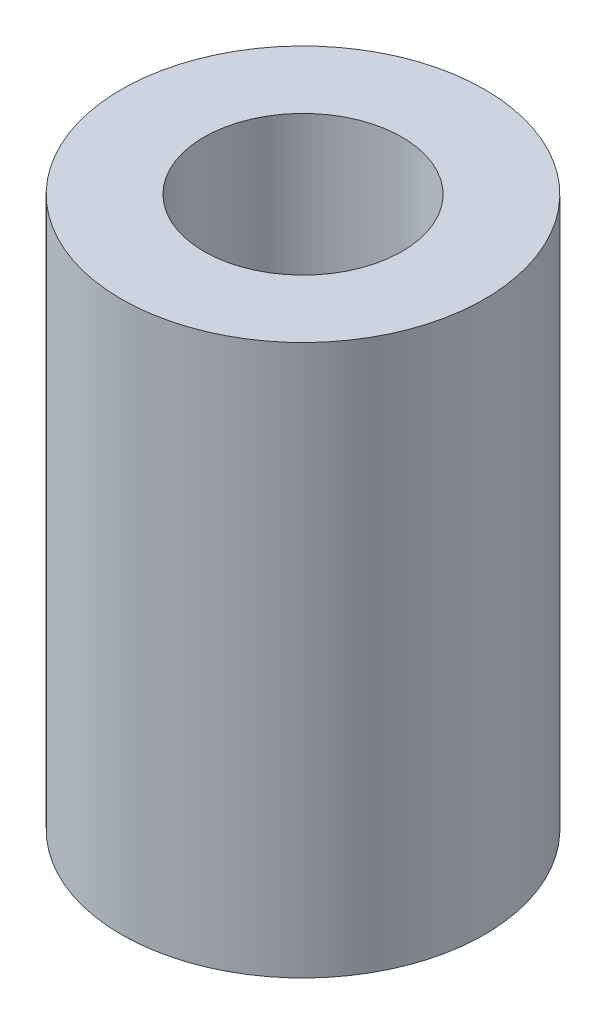
from build123d import *

# Parameters (mm, degrees)
SKETCH1_R           = 3.3
SKETCH1_R_2         = 1.8
BOSS_EXTRUDE1_DEPTH = 10


with BuildPart() as part:
    # Sketch1 → Boss-Extrude1 (new body)
    with BuildSketch(Plane(origin=(0, 0, 0), x_dir=(1, 0, 0), z_dir=(0, 1, 0))):
        with Locations(Location((0, 0, 0), (0, 0, 270))):
            Circle(SKETCH1_R)
        with Locations(Location((0, 0, 0), (0, 0, 270))):
            Circle(SKETCH1_R_2, mode=Mode.SUBTRACT)
    extrude(amount=BOSS_EXTRUDE1_DEPTH)


solid = part.part
